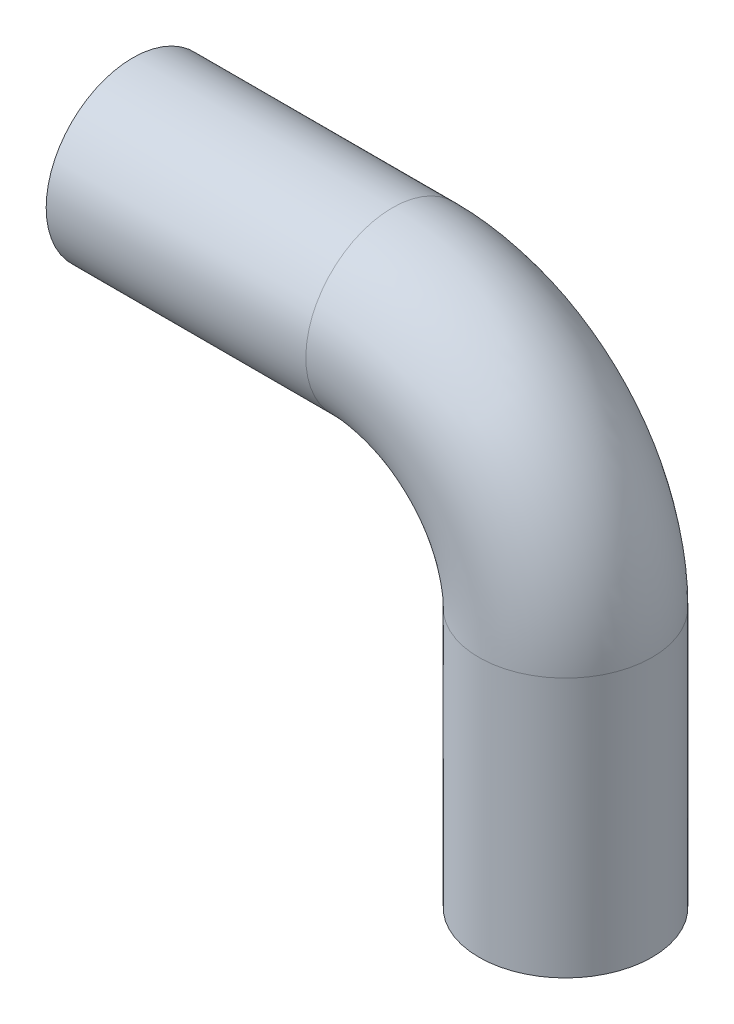
from build123d import *

# Parameters (mm, degrees)
SWEEP1_PROFILE_R = 10
SHELL4_T         = -2.3


with BuildPart() as part:
    # Sweep1: sweep along a path in Sketch1
    with BuildLine(Plane.XY) as sweep1_path:
        Line((0, 0), (30, 0))
        ThreePointArc((30, 0), (44.142135624, -5.857864376), (50, -20))
        Line((50, -20), (50, -50))
    # Sweep1 profile (on start of the path) → Sweep1 (sweep)
    with BuildSketch(Plane(origin=(0, 0, 0), x_dir=(0, 0, 1), z_dir=(1, 0, 0))):
        Circle(SWEEP1_PROFILE_R)
    sweep(path=sweep1_path.line)

    # Shell4
    shell4_openings = [part.faces().sort_by_distance(p)[0] for p in [
        (50, -50, 0),
        (0, 0, 0),
    ]]
    offset(amount=SHELL4_T, openings=shell4_openings, kind=Kind.INTERSECTION)


solid = part.part
